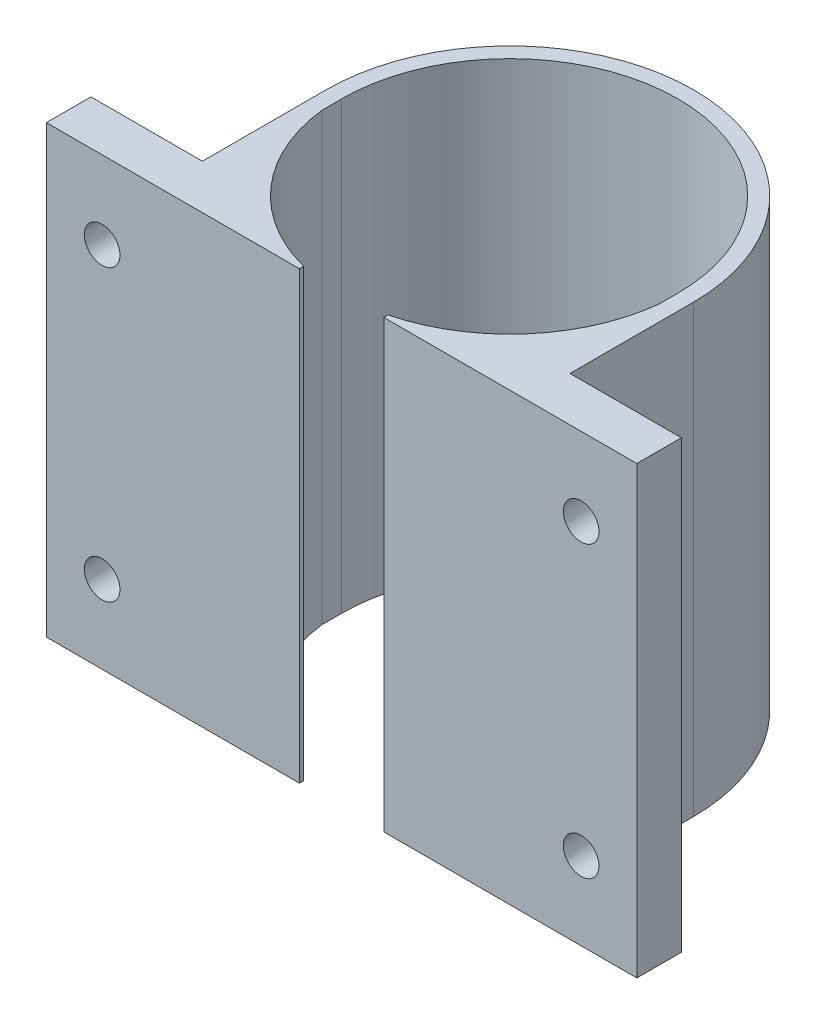
from build123d import *

# Parameters (mm, degrees)
BOSS_EXTRUDE3_DEPTH = 40
SKETCH8_W           = 4
SKETCH8_H           = 40
BOSS_EXTRUDE6_DEPTH = 10
SKETCH9_W           = 4
SKETCH9_H           = 40
BOSS_EXTRUDE7_DEPTH = 10
BOSS_EXTRUDE9_DEPTH = 40
CUT_EXTRUDE1_DEPTH  = 40


with BuildPart() as part:
    # Sketch3 → Boss-Extrude3 (new body)
    with BuildSketch(Plane(origin=(0, 0, 0), x_dir=(1, 0, 0), z_dir=(0, 1, 0))):
        with BuildLine():
            ThreePointArc((16.5, 0), (0, 16.5), (-16.5, 0))
            Line((-16.5, 0), (-16.5, -15.1))
            Line((-16.5, -15.1), (-15.1, -15.1))
            Line((-15.1, -15.1), (-15.1, 0))
            ThreePointArc((-15.1, 0), (0, 15.1), (15.1, 0))
            Line((15.1, 0), (15.1, -15.1))
            Line((15.1, -15.1), (16.5, -15.1))
            Line((16.5, -15.1), (16.5, 0))
        make_face()
    extrude(amount=BOSS_EXTRUDE3_DEPTH)

    # Sketch8 → Boss-Extrude6 (add)
    with BuildSketch(Plane(origin=(16.5, 0, 0), x_dir=(0, 0, -1), z_dir=(1, 0, 0))):
        with Locations((-13.1, 20)):
            Rectangle(SKETCH8_W, SKETCH8_H)
    extrude(amount=BOSS_EXTRUDE6_DEPTH)

    # Sketch9 → Boss-Extrude7 (add)
    with BuildSketch(Plane.ZY.offset(16.5)):
        with Locations((13.1, 20)):
            Rectangle(SKETCH9_W, SKETCH9_H)
    extrude(amount=BOSS_EXTRUDE7_DEPTH)

    # Sketch10 → Boss-Extrude9 (add)
    with BuildSketch(Plane(origin=(0, 0, 0), x_dir=(-1, 0, 0), z_dir=(0, -1, 0))):
        with BuildLine():
            Line((3.791332709, -15.1), (15.1, -15.1))
            Line((15.1, -15.1), (15.1, -1.740689519))
            ThreePointArc((15.1, -1.740689519), (11.460081139, -9.985316234), (3.791332709, -14.719571879))
            Line((3.791332709, -14.719571879), (3.791332709, -15.1))
        make_face()
        with BuildLine():
            Line((-15.1, -15.1), (-3.791332709, -15.1))
            Line((-3.791332709, -15.1), (-3.791332709, -14.719571879))
            ThreePointArc((-3.791332709, -14.719571879), (-11.460081139, -9.985316234), (-15.1, -1.740689519))
            Line((-15.1, -1.740689519), (-15.1, -15.1))
        make_face()
    extrude(amount=-BOSS_EXTRUDE9_DEPTH)

    # Sketch11 → Cut-Extrude1 (cut)
    with BuildSketch(Plane(origin=(0, 0, 11.1), x_dir=(-1, 0, 0), z_dir=(0, 0, -1))):
        with BuildLine():
            ThreePointArc((-19.9, 33), (-20.36862915, 34.13137085), (-21.5, 34.6))
            Line((-21.5, 34.6), (-21.5, 31.4))
            ThreePointArc((-21.5, 31.4), (-20.36862915, 31.86862915), (-19.9, 33))
        make_face()
        with BuildLine():
            Line((-21.5, 31.4), (-21.5, 34.6))
            ThreePointArc((-21.5, 34.6), (-23.1, 33), (-21.5, 31.4))
        make_face()
        with BuildLine():
            ThreePointArc((-19.9, 7), (-20.36862915, 8.13137085), (-21.5, 8.6))
            Line((-21.5, 8.6), (-21.5, 5.4))
            ThreePointArc((-21.5, 5.4), (-20.36862915, 5.86862915), (-19.9, 7))
        make_face()
        with BuildLine():
            Line((-21.5, 5.4), (-21.5, 8.6))
            ThreePointArc((-21.5, 8.6), (-23.1, 7), (-21.5, 5.4))
        make_face()
        with BuildLine():
            ThreePointArc((23.1, 7), (22.63137085, 8.13137085), (21.5, 8.6))
            Line((21.5, 8.6), (21.5, 5.4))
            ThreePointArc((21.5, 5.4), (22.63137085, 5.86862915), (23.1, 7))
        make_face()
        with BuildLine():
            Line((21.5, 5.4), (21.5, 8.6))
            ThreePointArc((21.5, 8.6), (19.9, 7), (21.5, 5.4))
        make_face()
        with BuildLine():
            ThreePointArc((23.1, 33), (22.63137085, 34.13137085), (21.5, 34.6))
            Line((21.5, 34.6), (21.5, 31.4))
            ThreePointArc((21.5, 31.4), (22.63137085, 31.86862915), (23.1, 33))
        make_face()
        with BuildLine():
            Line((21.5, 31.4), (21.5, 34.6))
            ThreePointArc((21.5, 34.6), (19.9, 33), (21.5, 31.4))
        make_face()
    extrude(amount=-CUT_EXTRUDE1_DEPTH, mode=Mode.SUBTRACT)


solid = part.part
